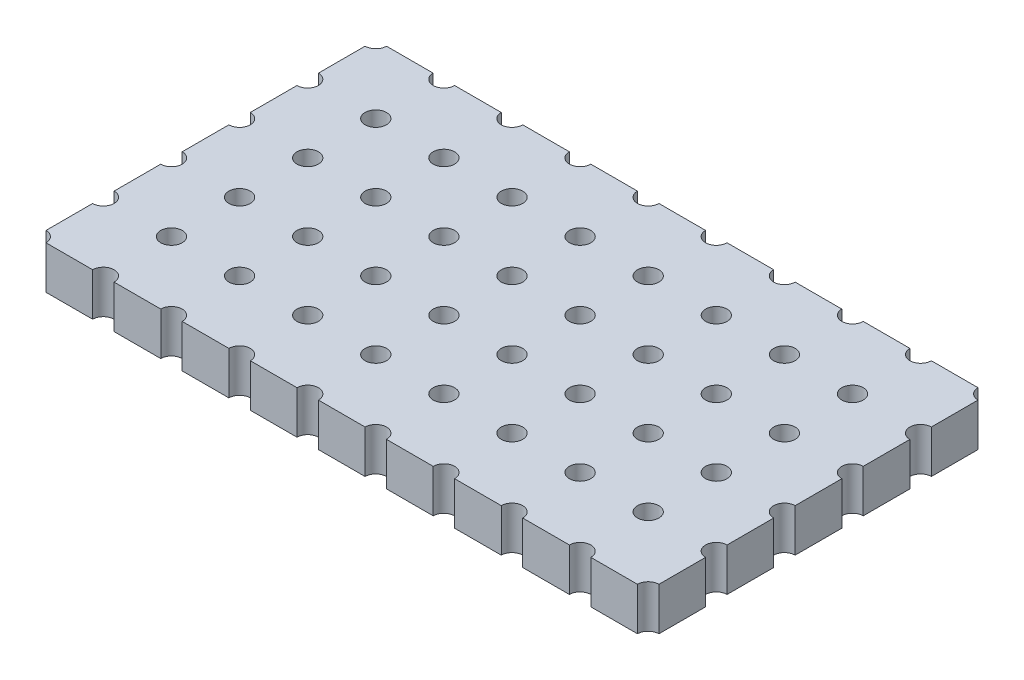
from build123d import *

# Parameters (mm, degrees)
SKETCH2_W            = 22.86
SKETCH2_H            = 12.7
BOSS_EXTRUDE1_DEPTH  = 0.8
SKETCH3_R            = 0.4
CUT_EXTRUDE1_DEPTH   = 14.172979921
LPATTERN1_COUNT      = 10
LPATTERN1_PITCH      = 2.54
LPATTERN1_COUNT_DIR2 = 6
LPATTERN1_PITCH_DIR2 = 2.54


with BuildPart() as part:
    # Sketch2 → Boss-Extrude1 (new, symmetric)
    with BuildSketch(Plane(origin=(0, 0, 0), x_dir=(1, 0, 0), z_dir=(0, 1, 0))):
        Rectangle(SKETCH2_W, SKETCH2_H)
    extrude(amount=BOSS_EXTRUDE1_DEPTH, both=True)

    # Sketch3 → Cut-Extrude1 (cut, through all)
    with BuildSketch(Plane(origin=(0, 0.8, 0), x_dir=(1, 0, 0), z_dir=(0, 1, 0))):
        with Locations((-11.43, 6.35)):
            Circle(SKETCH3_R)
    cut_extrude1 = extrude(amount=-CUT_EXTRUDE1_DEPTH, mode=Mode.SUBTRACT)

    # LPattern1: Cut-Extrude1 10 × 6
    with Locations(*[(i * LPATTERN1_PITCH, 0, j * LPATTERN1_PITCH_DIR2) for i in range(LPATTERN1_COUNT) for j in range(LPATTERN1_COUNT_DIR2) if (i, j) != (0, 0)]):
        add(cut_extrude1, mode=Mode.SUBTRACT)


solid = part.part
